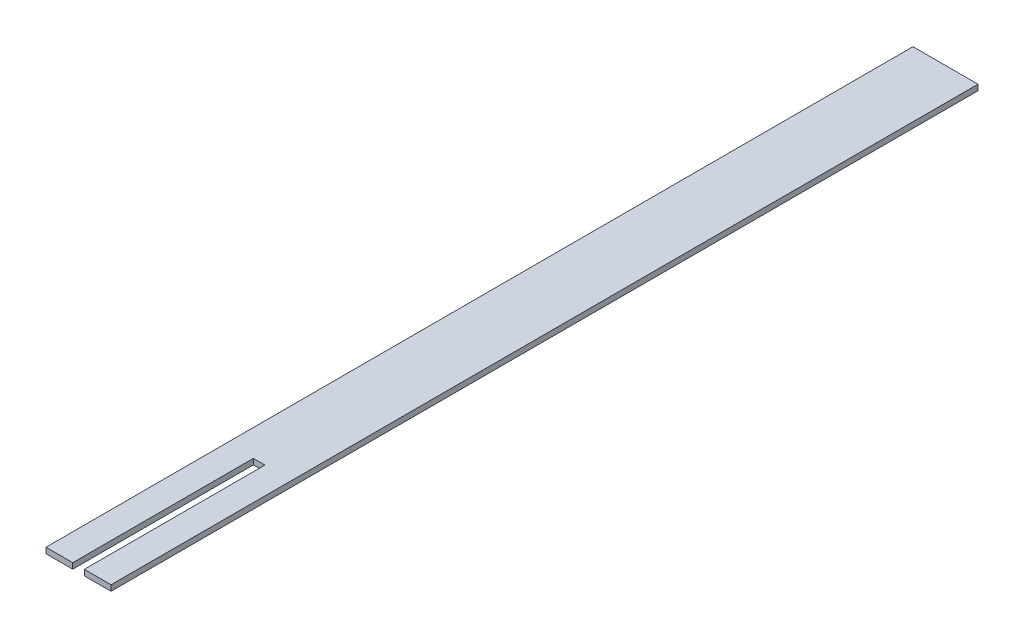
from build123d import *

# Parameters (mm, degrees)
BOSS_EXTRUDE1_DEPTH = 5


with BuildPart() as part:
    # Sketch1 → Boss-Extrude1 (new body)
    with BuildSketch(Plane(origin=(0, 0, 0), x_dir=(1, 0, 0), z_dir=(0, 1, 0))):
        Polygon((0, 0), (57.15, 0), (57.15, -762), (33.655, -762), (33.655, -603.25), (23.495, -603.25), (23.495, -762), (0, -762), align=None)
    extrude(amount=BOSS_EXTRUDE1_DEPTH)


solid = part.part
